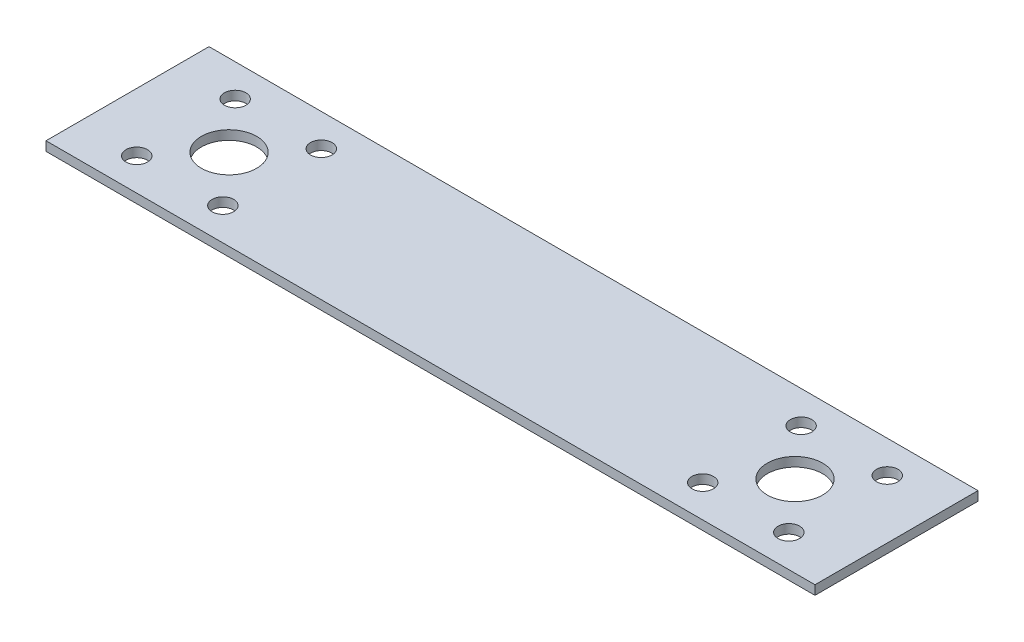
from build123d import *

# Parameters (mm, degrees)
SKETCH4_R           = 1.75
SKETCH4_R_2         = 4.5
BOSS_EXTRUDE1_DEPTH = 1.5


with BuildPart() as part:
    # Sketch4 → Boss-Extrude1 (new body)
    with BuildSketch(Plane(origin=(0, 0, 0), x_dir=(1, 0, 0), z_dir=(0, 1, 0))):
        Polygon((-30.158983798, 50.908297492), (-63.158983798, 50.908297492), (-63.158983798, 24.408297492), (-30.158983798, 24.408297492), (28.841016202, 24.408297492), (61.841016202, 24.408297492), (61.841016202, 50.908297492), (28.841016202, 50.908297492), align=None)
        with Locations(Location((-53.658983798, 29.658297492, 0), (0, 0, 270))):
            Circle(SKETCH4_R, mode=Mode.SUBTRACT)
        with Locations(Location((-39.658983798, 29.658297492, 0), (0, 0, 270))):
            Circle(SKETCH4_R, mode=Mode.SUBTRACT)
        with Locations(Location((38.341016202, 29.658297492, 0), (0, 0, 270))):
            Circle(SKETCH4_R, mode=Mode.SUBTRACT)
        with Locations(Location((52.341016202, 29.658297492, 0), (0, 0, 270))):
            Circle(SKETCH4_R, mode=Mode.SUBTRACT)
        with Locations(Location((-46.658983798, 37.658297492, 0), (0, 0, 270))):
            Circle(SKETCH4_R_2, mode=Mode.SUBTRACT)
        with Locations(Location((-53.658983798, 45.658297492, 0), (0, 0, 270))):
            Circle(SKETCH4_R, mode=Mode.SUBTRACT)
        with Locations(Location((-39.658983798, 45.658297492, 0), (0, 0, 270))):
            Circle(SKETCH4_R, mode=Mode.SUBTRACT)
        with Locations(Location((45.341016202, 37.658297492, 0), (0, 0, 270))):
            Circle(SKETCH4_R_2, mode=Mode.SUBTRACT)
        with Locations(Location((38.341016202, 45.658297492, 0), (0, 0, 270))):
            Circle(SKETCH4_R, mode=Mode.SUBTRACT)
        with Locations(Location((52.341016202, 45.658297492, 0), (0, 0, 270))):
            Circle(SKETCH4_R, mode=Mode.SUBTRACT)
    extrude(amount=BOSS_EXTRUDE1_DEPTH)


solid = part.part
